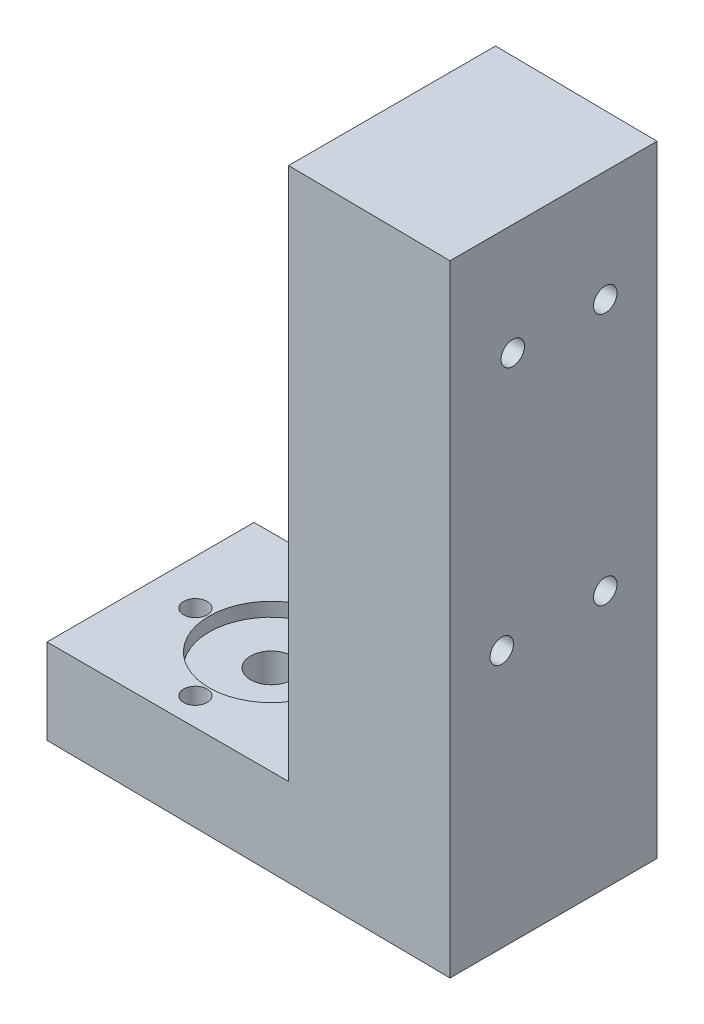
from build123d import *

# Parameters (mm, degrees)
BOSS_EXTRUDE1_DEPTH = 30
CUT_EXTRUDE1_REACH  = 103.41
SKETCH2_R           = 3
SKETCH2_R_2         = 1.7
SKETCH3_R           = 9
CUT_EXTRUDE2_DEPTH  = 2
CUT_EXTRUDE3_REACH  = 102.783
SKETCH4_R           = 1.7


with BuildPart() as part:
    # Sketch1 → Boss-Extrude1 (new body)
    with BuildSketch(Plane.XY):
        Polygon((0, 0), (58.399287612, -0.629459459), (58.399287612, 89.370540541), (35, 89.622750859), (35, 12.334557553), (0, 12.334557553), align=None)
    extrude(amount=BOSS_EXTRUDE1_DEPTH)

    # Cut-Extrude1: up to this plane
    cut_extrude1_end = Plane(origin=(0, 0, 30), z_dir=(0.010777920827534888, 0.9999419165244726, 0))
    # Sketch2 → Cut-Extrude1 (cut, up to the surface)
    with BuildSketch(Plane(origin=(0, 12.334557553, 0), x_dir=(1, 0, 0), z_dir=(0, 1, 0)), mode=Mode.PRIVATE) as cut_extrude1_sk1:
        with Locations(Location((17.5, -15, 0), (0, 0, 180))):
            Circle(SKETCH2_R)
    cut_extrude1_tool1 = split(extrude(cut_extrude1_sk1.sketch, amount=-CUT_EXTRUDE1_REACH, mode=Mode.PRIVATE), bisect_by=cut_extrude1_end, keep=Keep.BOTH, mode=Mode.PRIVATE)
    add(cut_extrude1_tool1.solids().sort_by_distance((17.5, 12.334558, 15))[0], mode=Mode.SUBTRACT)
    # Sketch2 → Cut-Extrude1 (cut, up to the surface)
    with BuildSketch(Plane(origin=(0, 12.334557553, 0), x_dir=(1, 0, 0), z_dir=(0, 1, 0)), mode=Mode.PRIVATE) as cut_extrude1_sk2:
        with Locations(Location((6.5, -15, 0), (0, 0, 180))):
            Circle(SKETCH2_R_2)
    cut_extrude1_tool2 = split(extrude(cut_extrude1_sk2.sketch, amount=-CUT_EXTRUDE1_REACH, mode=Mode.PRIVATE), bisect_by=cut_extrude1_end, keep=Keep.BOTH, mode=Mode.PRIVATE)
    add(cut_extrude1_tool2.solids().sort_by_distance((6.5, 12.334558, 15))[0], mode=Mode.SUBTRACT)
    # Sketch2 → Cut-Extrude1 (cut, up to the surface)
    with BuildSketch(Plane(origin=(0, 12.334557553, 0), x_dir=(1, 0, 0), z_dir=(0, 1, 0)), mode=Mode.PRIVATE) as cut_extrude1_sk3:
        with Locations(Location((17.5, -4, 0), (0, 0, 180))):
            Circle(SKETCH2_R_2)
    cut_extrude1_tool3 = split(extrude(cut_extrude1_sk3.sketch, amount=-CUT_EXTRUDE1_REACH, mode=Mode.PRIVATE), bisect_by=cut_extrude1_end, keep=Keep.BOTH, mode=Mode.PRIVATE)
    add(cut_extrude1_tool3.solids().sort_by_distance((17.5, 12.334558, 4))[0], mode=Mode.SUBTRACT)
    # Sketch2 → Cut-Extrude1 (cut, up to the surface)
    with BuildSketch(Plane(origin=(0, 12.334557553, 0), x_dir=(1, 0, 0), z_dir=(0, 1, 0)), mode=Mode.PRIVATE) as cut_extrude1_sk4:
        with Locations(Location((28.5, -15, 0), (0, 0, 180))):
            Circle(SKETCH2_R_2)
    cut_extrude1_tool4 = split(extrude(cut_extrude1_sk4.sketch, amount=-CUT_EXTRUDE1_REACH, mode=Mode.PRIVATE), bisect_by=cut_extrude1_end, keep=Keep.BOTH, mode=Mode.PRIVATE)
    add(cut_extrude1_tool4.solids().sort_by_distance((28.5, 12.334558, 15))[0], mode=Mode.SUBTRACT)
    # Sketch2 → Cut-Extrude1 (cut, up to the surface)
    with BuildSketch(Plane(origin=(0, 12.334557553, 0), x_dir=(1, 0, 0), z_dir=(0, 1, 0)), mode=Mode.PRIVATE) as cut_extrude1_sk5:
        with Locations(Location((17.5, -26, 0), (0, 0, 180))):
            Circle(SKETCH2_R_2)
    cut_extrude1_tool5 = split(extrude(cut_extrude1_sk5.sketch, amount=-CUT_EXTRUDE1_REACH, mode=Mode.PRIVATE), bisect_by=cut_extrude1_end, keep=Keep.BOTH, mode=Mode.PRIVATE)
    add(cut_extrude1_tool5.solids().sort_by_distance((17.5, 12.334558, 26))[0], mode=Mode.SUBTRACT)

    # Sketch3 → Cut-Extrude2 (cut)
    with BuildSketch(Plane(origin=(0, 12.334557553, 0), x_dir=(1, 0, 0), z_dir=(0, 1, 0))):
        with Locations(Location((17.5, -15, 0), (0, 0, 180))):
            Circle(SKETCH3_R)
    extrude(amount=-CUT_EXTRUDE2_DEPTH, mode=Mode.SUBTRACT)

    # Sketch4 → Cut-Extrude3 (cut, up to next)
    with BuildSketch(Plane.ZY.offset(-35), mode=Mode.PRIVATE) as cut_extrude3_sk1:
        with Locations(Location((22.5, 36.700540541, 0), (0, 0, 270))):
            Circle(SKETCH4_R)
    cut_extrude3_tool1 = extrude(cut_extrude3_sk1.sketch, amount=-CUT_EXTRUDE3_REACH, mode=Mode.PRIVATE) & part.part
    # Sketch4 → Cut-Extrude3 (cut, up to next)
    with BuildSketch(Plane.ZY.offset(-35), mode=Mode.PRIVATE) as cut_extrude3_sk2:
        with Locations(Location((7.5, 36.700540541, 0), (0, 0, 270))):
            Circle(SKETCH4_R)
    cut_extrude3_tool2 = extrude(cut_extrude3_sk2.sketch, amount=-CUT_EXTRUDE3_REACH, mode=Mode.PRIVATE) & part.part
    # Sketch4 → Cut-Extrude3 (cut, up to next)
    with BuildSketch(Plane.ZY.offset(-35), mode=Mode.PRIVATE) as cut_extrude3_sk3:
        with Locations(Location((7.5, 73.270540541, 0), (0, 0, 270))):
            Circle(SKETCH4_R)
    cut_extrude3_tool3 = extrude(cut_extrude3_sk3.sketch, amount=-CUT_EXTRUDE3_REACH, mode=Mode.PRIVATE) & part.part
    # Sketch4 → Cut-Extrude3 (cut, up to next)
    with BuildSketch(Plane.ZY.offset(-35), mode=Mode.PRIVATE) as cut_extrude3_sk4:
        with Locations(Location((20.905297153, 73.270540541, 0), (0, 0, 270))):
            Circle(SKETCH4_R)
    cut_extrude3_tool4 = extrude(cut_extrude3_sk4.sketch, amount=-CUT_EXTRUDE3_REACH, mode=Mode.PRIVATE) & part.part
    add(cut_extrude3_tool1.solids().sort_by_distance((35, 36.700541, 22.5))[0], mode=Mode.SUBTRACT)
    add(cut_extrude3_tool2.solids().sort_by_distance((35, 36.700541, 7.5))[0], mode=Mode.SUBTRACT)
    add(cut_extrude3_tool3.solids().sort_by_distance((35, 73.270541, 7.5))[0], mode=Mode.SUBTRACT)
    add(cut_extrude3_tool4.solids().sort_by_distance((35, 73.270541, 20.905297))[0], mode=Mode.SUBTRACT)


solid = part.part
